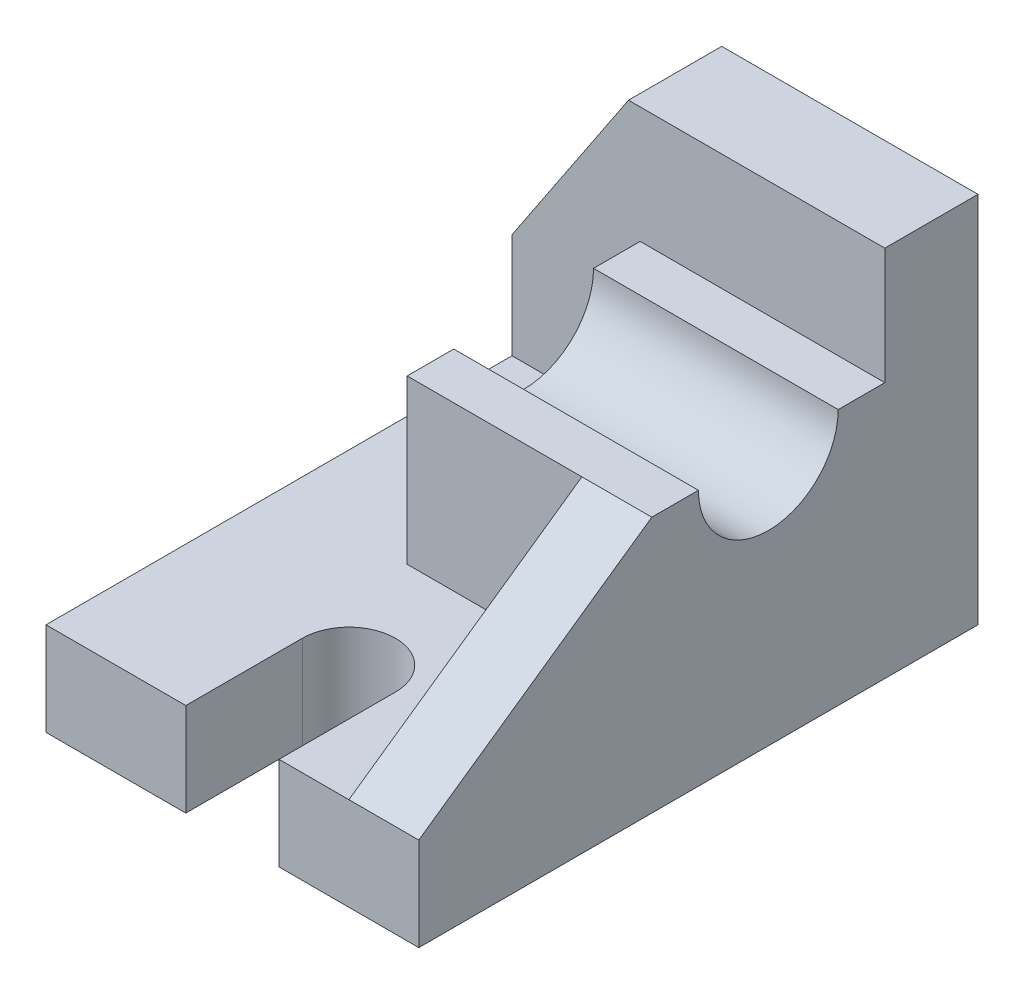
from build123d import *

# Parameters (mm, degrees)
Y_KSEKLIK_EKSTR_ZYON1_DEPTH = 64
KES_EKSTR_ZYON1_DEPTH       = 16
KES_EKSTR_ZYON2_DEPTH       = 16
IZIM7_W                     = 42
IZIM7_H                     = 40
Y_KSEKLIK_EKSTR_ZYON2_DEPTH = 28
IZIM9_R                     = 12
KES_EKSTR_ZYON3_DEPTH       = 42
Y_KSEKLIK_EKSTR_ZYON3_DEPTH = 12


with BuildPart() as part:
    # Çizim4 → Yükseklik-Ekstrüzyon1 (new body)
    with BuildSketch(Plane(origin=(0, 0, 0), x_dir=(0, 0, -1), z_dir=(1, 0, 0))):
        Polygon((0, 0), (0, 64), (-16, 64), (-16, 16), (-96, 16), (-96, 0), align=None)
    extrude(amount=-Y_KSEKLIK_EKSTR_ZYON1_DEPTH)

    # Çizim5 → Kes-Ekstrüzyon1 (cut)
    with BuildSketch(Plane.XY.offset(16)):
        Polygon((-64, 64), (-44, 64), (-64, 34), align=None)
    extrude(amount=-KES_EKSTR_ZYON1_DEPTH, mode=Mode.SUBTRACT)

    # Çizim6 → Kes-Ekstrüzyon2 (cut)
    with BuildSketch(Plane(origin=(0, 16, 0), x_dir=(1, 0, 0), z_dir=(0, 1, 0))):
        with BuildLine():
            Line((-40, -96), (-40, -76))
            ThreePointArc((-40, -76), (-32, -68), (-24, -76))
            Line((-24, -76), (-24, -96))
            Line((-24, -96), (-40, -96))
        make_face()
    extrude(amount=-KES_EKSTR_ZYON2_DEPTH, mode=Mode.SUBTRACT)

    # Çizim7 → Yükseklik-Ekstrüzyon2 (add)
    with BuildSketch(Plane(origin=(0, 16, 0), x_dir=(1, 0, 0), z_dir=(0, 1, 0))):
        with Locations((-21, -36)):
            Rectangle(IZIM7_W, IZIM7_H)
    extrude(amount=Y_KSEKLIK_EKSTR_ZYON2_DEPTH)

    # Çizim9 → Kes-Ekstrüzyon3 (cut)
    with BuildSketch(Plane(origin=(0, 0, 0), x_dir=(0, 0, -1), z_dir=(1, 0, 0))):
        with Locations((-36, 44)):
            Circle(IZIM9_R)
    extrude(amount=-KES_EKSTR_ZYON3_DEPTH, mode=Mode.SUBTRACT)

    # Çizim10 → Yükseklik-Ekstrüzyon3 (add)
    with BuildSketch(Plane(origin=(0, 0, 0), x_dir=(0, 0, -1), z_dir=(1, 0, 0))):
        Polygon((-56, 44), (-96, 16), (-56, 16), align=None)
    extrude(amount=-Y_KSEKLIK_EKSTR_ZYON3_DEPTH)


solid = part.part
